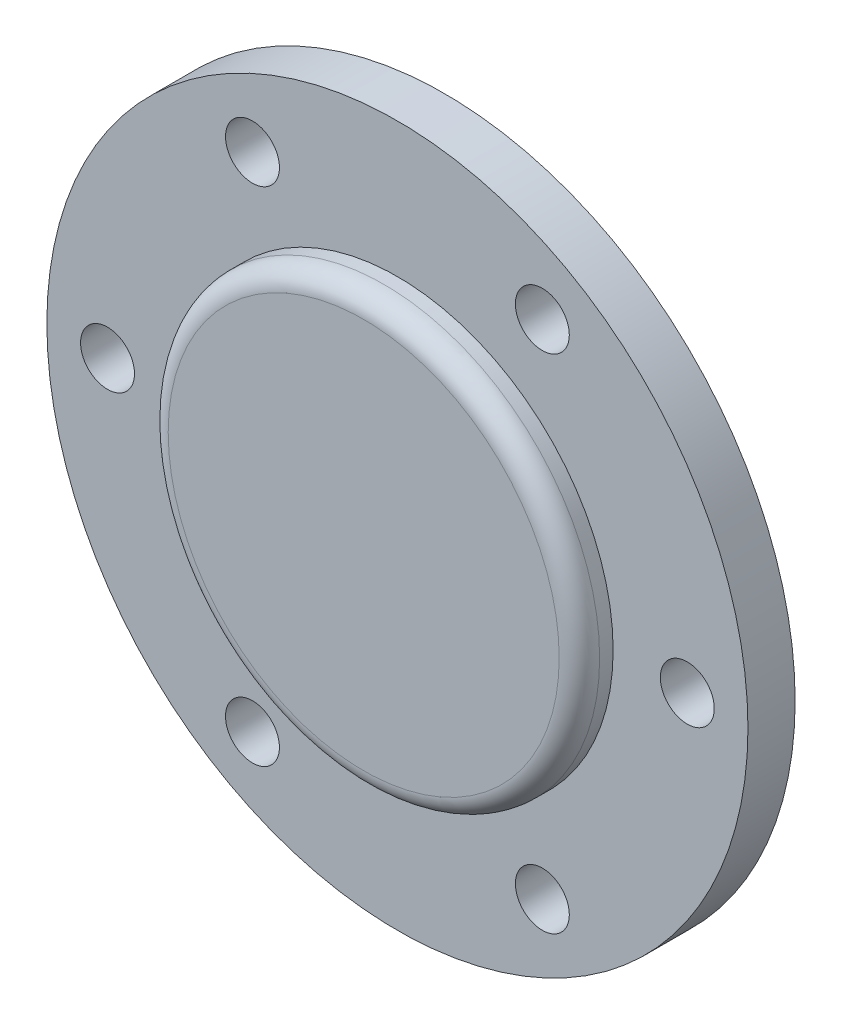
from build123d import *

# Parameters (mm, degrees)
SKETCH1_R           = 26
SKETCH1_R_2         = 2
BOSS_EXTRUDE1_DEPTH = 3.5
SKETCH2_R           = 16
BOSS_EXTRUDE2_DEPTH = 2.5
FILLET1_R           = 1.5
SKETCH3_R           = 15
BOSS_EXTRUDE3_DEPTH = 1


with BuildPart() as part:
    # Sketch1 → Boss-Extrude1 (new body)
    with BuildSketch(Plane.XY):
        Circle(SKETCH1_R)
        with Locations((-21.5, 0)):
            Circle(SKETCH1_R_2, mode=Mode.SUBTRACT)
        with Locations((-10.75, 18.619546181)):
            Circle(SKETCH1_R_2, mode=Mode.SUBTRACT)
        with Locations((10.75, 18.619546181)):
            Circle(SKETCH1_R_2, mode=Mode.SUBTRACT)
        with Locations((21.5, 0)):
            Circle(SKETCH1_R_2, mode=Mode.SUBTRACT)
        with Locations((10.75, -18.619546181)):
            Circle(SKETCH1_R_2, mode=Mode.SUBTRACT)
        with Locations((-10.75, -18.619546181)):
            Circle(SKETCH1_R_2, mode=Mode.SUBTRACT)
    extrude(amount=BOSS_EXTRUDE1_DEPTH)

    # Sketch2 → Boss-Extrude2 (add)
    with BuildSketch(Plane.XY.offset(3.5)):
        Circle(SKETCH2_R)
    extrude(amount=BOSS_EXTRUDE2_DEPTH)

    # Fillet1
    fillet1_edges = [part.edges().sort_by_distance(p)[0] for p in [
        (-16, 0, 6),
    ]]
    fillet(fillet1_edges, radius=FILLET1_R)

    # Sketch3 → Boss-Extrude3 (add)
    with BuildSketch(Plane(origin=(0, 0, 0), x_dir=(-1, 0, 0), z_dir=(0, 0, -1))):
        Circle(SKETCH3_R)
    extrude(amount=BOSS_EXTRUDE3_DEPTH)


solid = part.part
